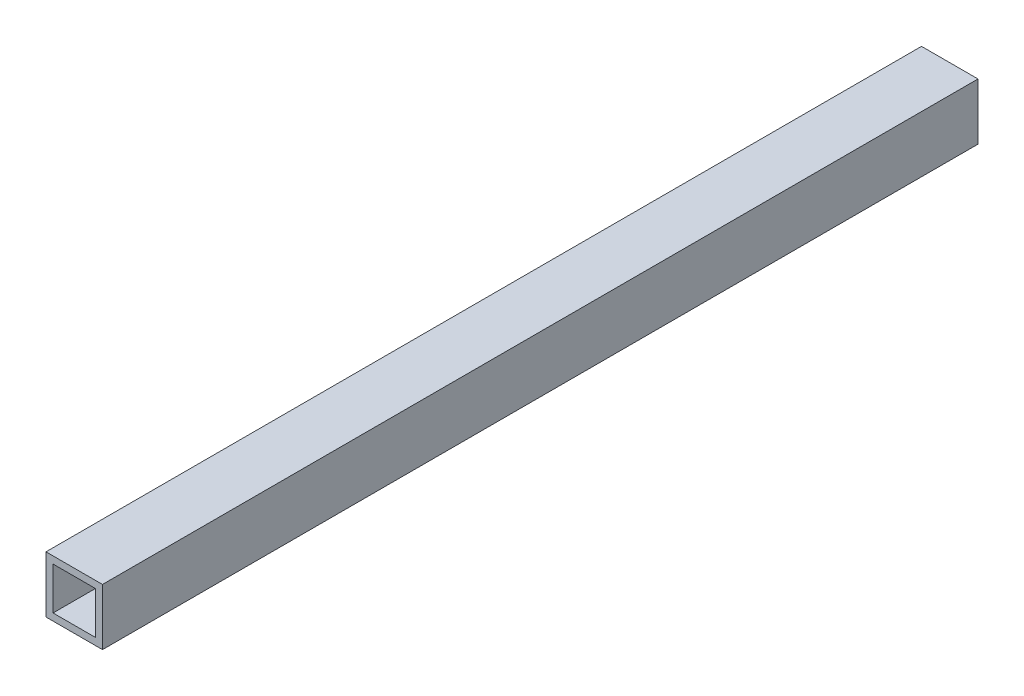
from build123d import *

# Parameters (mm, degrees)
SKETCH1_W           = 25.4
SKETCH1_H           = 25.4
SKETCH1_W_2         = 19.05
SKETCH1_H_2         = 19.05
BOSS_EXTRUDE1_DEPTH = 196.85


with BuildPart() as part:
    # Sketch1 → Boss-Extrude1 (new, symmetric)
    with BuildSketch(Plane.XY):
        Rectangle(SKETCH1_W, SKETCH1_H)
        Rectangle(SKETCH1_W_2, SKETCH1_H_2, mode=Mode.SUBTRACT)
    extrude(amount=BOSS_EXTRUDE1_DEPTH, both=True)


solid = part.part
